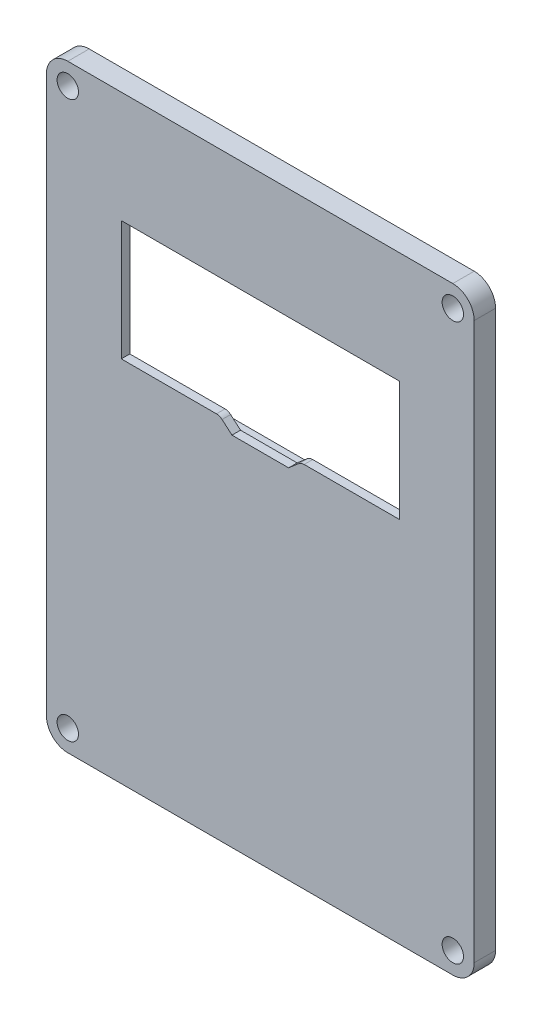
from build123d import *

# Parameters (mm, degrees)
SKETCH1_R           = 2.5
BOSS_EXTRUDE1_DEPTH = 5
CUT_EXTRUDE1_DEPTH  = 5
SKETCH2_4_W         = 76
SKETCH2_4_H         = 36
CUT_EXTRUDE2_DEPTH  = 3


with BuildPart() as part:
    # Sketch1 → Boss-Extrude1 (new body)
    with BuildSketch(Plane.XY):
        with BuildLine():
            Line((45, 70), (-45, 70))
            ThreePointArc((-45, 70), (-48.535533906, 68.535533906), (-50, 65))
            Line((-50, 65), (-50, -65))
            ThreePointArc((-50, -65), (-48.535533906, -68.535533906), (-45, -70))
            Line((-45, -70), (45, -70))
            ThreePointArc((45, -70), (48.535533906, -68.535533906), (50, -65))
            Line((50, -65), (50, 65))
            ThreePointArc((50, 65), (48.535533906, 68.535533906), (45, 70))
        make_face()
        with Locations((-45, -65)):
            Circle(SKETCH1_R, mode=Mode.SUBTRACT)
        with Locations((45, -65)):
            Circle(SKETCH1_R, mode=Mode.SUBTRACT)
        with Locations((45, 65)):
            Circle(SKETCH1_R, mode=Mode.SUBTRACT)
        with Locations((-45, 65)):
            Circle(SKETCH1_R, mode=Mode.SUBTRACT)
    extrude(amount=BOSS_EXTRUDE1_DEPTH)

    # Sketch2 → Cut-Extrude1 (cut)
    with BuildSketch(Plane(origin=(0, 0, 0), x_dir=(-1, 0, 0), z_dir=(0, 0, -1))):
        with BuildLine():
            ThreePointArc((-10.247345781, 16), (-9.547279148, 15.873474502), (-8.935788795, 15.50990671))
            Line((-8.935788795, 15.50990671), (-6.621919354, 13.5))
            Line((-6.621919354, 13.5), (6.621919354, 13.5))
            Line((6.621919354, 13.5), (8.935788795, 15.50990671))
            ThreePointArc((8.935788795, 15.50990671), (9.547279148, 15.873474502), (10.247345781, 16))
            Line((10.247345781, 16), (32.5, 16))
            Line((32.5, 16), (32.5, 44))
            Line((32.5, 44), (-32.5, 44))
            Line((-32.5, 44), (-32.5, 16))
            Line((-32.5, 16), (-10.247345781, 16))
        make_face()
    extrude(amount=-CUT_EXTRUDE1_DEPTH, mode=Mode.SUBTRACT)

    # Sketch2<4> → Cut-Extrude2 (cut)
    with BuildSketch(Plane(origin=(0, 0, 0), x_dir=(-1, 0, 0), z_dir=(0, 0, -1))):
        with Locations((0, 30)):
            Rectangle(SKETCH2_4_W, SKETCH2_4_H)
        with BuildLine():
            Line((-8.935788795, 15.50990671), (-6.621919354, 13.5))
            Line((-6.621919354, 13.5), (6.621919354, 13.5))
            Line((6.621919354, 13.5), (8.935788795, 15.50990671))
            ThreePointArc((8.935788795, 15.50990671), (9.547279148, 15.873474502), (10.247345781, 16))
            Line((10.247345781, 16), (32.5, 16))
            Line((32.5, 16), (32.5, 44))
            Line((32.5, 44), (-32.5, 44))
            Line((-32.5, 44), (-32.5, 16))
            Line((-32.5, 16), (-10.247345781, 16))
            ThreePointArc((-10.247345781, 16), (-9.547279148, 15.873474502), (-8.935788795, 15.50990671))
        make_face(mode=Mode.SUBTRACT)
    extrude(amount=-CUT_EXTRUDE2_DEPTH, mode=Mode.SUBTRACT)


solid = part.part
